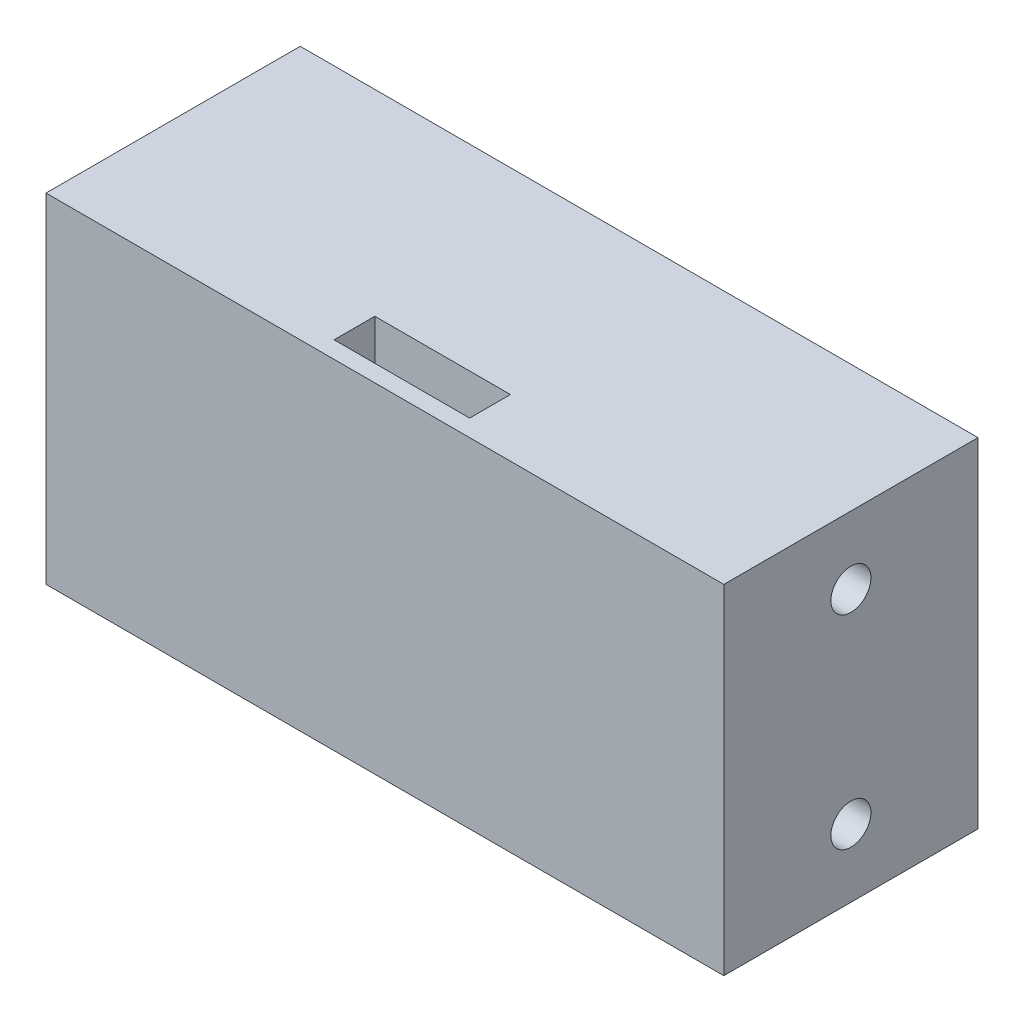
from build123d import *

# Parameters (mm, degrees)
SKETCH1_W           = 50.8
SKETCH1_H           = 25.4
BOSS_EXTRUDE1_DEPTH = 19.05
SKETCH4_W           = 10.16
SKETCH4_H           = 3.054556314
CUT_EXTRUDE2_DEPTH  = 19.05
SKETCH5_W           = 10.16
SKETCH5_H           = 3.175
CUT_EXTRUDE3_DEPTH  = 17.78
SKETCH6_R           = 1.5
CUT_EXTRUDE4_DEPTH  = 10.16
CUT_EXTRUDE5_START  = -10.16
SKETCH7_R           = 1.5
CUT_EXTRUDE5_DEPTH  = 10.16
SKETCH8_R           = 1.5
CUT_EXTRUDE6_DEPTH  = 10.16


with BuildPart() as part:
    # Sketch1 → Boss-Extrude1 (new body)
    with BuildSketch(Plane.XY):
        Rectangle(SKETCH1_W, SKETCH1_H)
    extrude(amount=BOSS_EXTRUDE1_DEPTH)

    # Sketch4 → Cut-Extrude2 (cut)
    with BuildSketch(Plane(origin=(0, 12.7, 0), x_dir=(1, 0, 0), z_dir=(0, 1, 0))):
        with Locations((0, -16.252721843)):
            Rectangle(SKETCH4_W, SKETCH4_H)
    extrude(amount=-CUT_EXTRUDE2_DEPTH, mode=Mode.SUBTRACT)

    # Sketch5 → Cut-Extrude3 (cut)
    with BuildSketch(Plane(origin=(0, 0, 0), x_dir=(-1, 0, 0), z_dir=(0, 0, -1))):
        with Locations((0, -7.9375)):
            Rectangle(SKETCH5_W, SKETCH5_H)
    extrude(amount=-CUT_EXTRUDE3_DEPTH, mode=Mode.SUBTRACT)

    # Sketch6 → Cut-Extrude4 (cut)
    with BuildSketch(Plane.ZY.offset(25.4)):
        with Locations((9.525, -7.62)):
            Circle(SKETCH6_R)
        with Locations((9.525, 7.62)):
            Circle(SKETCH6_R)
    extrude(amount=-CUT_EXTRUDE4_DEPTH, mode=Mode.SUBTRACT)

    # Sketch7 → Cut-Extrude5 (cut)
    with BuildSketch(Plane(origin=(25.4, 0, 0), x_dir=(0, 0, -1), z_dir=(1, 0, 0)).offset(CUT_EXTRUDE5_START)):
        with Locations(Location((-9.525, 7.62, 0), (0, 0, 180))):
            Circle(SKETCH7_R)
        with Locations(Location((-9.525, -7.62, 0), (0, 0, 180))):
            Circle(SKETCH7_R)
    extrude(amount=CUT_EXTRUDE5_DEPTH, mode=Mode.SUBTRACT)

    # Sketch8 → Cut-Extrude6 (cut)
    with BuildSketch(Plane(origin=(0, 0, 0), x_dir=(-1, 0, 0), z_dir=(0, 0, -1))):
        with Locations((22.225, 0)):
            Circle(SKETCH8_R)
        with Locations((-22.225, 0)):
            Circle(SKETCH8_R)
    extrude(amount=-CUT_EXTRUDE6_DEPTH, mode=Mode.SUBTRACT)


solid = part.part
